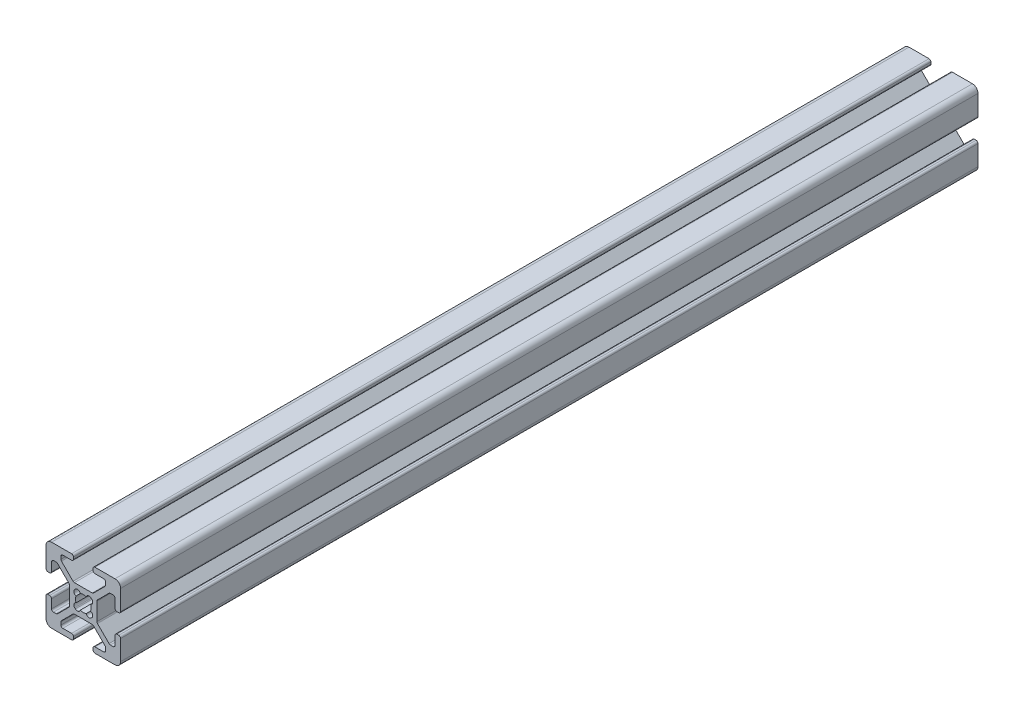
from build123d import *

# Parameters (mm, degrees)
BOSS_EXTRUDE1_DEPTH = 115


with BuildPart() as part:
    # Sketch1 → Boss-Extrude1 (new, symmetric)
    with BuildSketch(Plane.XY):
        with BuildLine():
            Line((10, 3.138), (10, 8.5))
            ThreePointArc((10, 8.5), (9.560660172, 9.560660172), (8.5, 10))
            Line((8.5, 10), (3.138, 10))
            ThreePointArc((3.138, 10), (2.778789755, 9.851210245), (2.63, 9.492))
            Line((2.63, 9.492), (2.63, 9.008))
            ThreePointArc((2.63, 9.008), (2.778789755, 8.648789755), (3.138, 8.5))
            Line((3.138, 8.5), (5.487, 8.5))
            ThreePointArc((5.487, 8.5), (5.846210245, 8.351210245), (5.995, 7.992))
            Line((5.995, 7.992), (5.995, 7.266080661))
            ThreePointArc((5.995, 7.266080661), (5.956330803, 7.071677478), (5.846210245, 6.906870417))
            Line((5.846210245, 6.906870417), (2.743129583, 3.803789755))
            ThreePointArc((2.743129583, 3.803789755), (2.578322522, 3.693669197), (2.383919339, 3.655))
            Line((2.383919339, 3.655), (-2.383919339, 3.655))
            ThreePointArc((-2.383919339, 3.655), (-2.578322522, 3.693669197), (-2.743129583, 3.803789755))
            Line((-2.743129583, 3.803789755), (-5.846210245, 6.906870417))
            ThreePointArc((-5.846210245, 6.906870417), (-5.956330803, 7.071677478), (-5.995, 7.266080661))
            Line((-5.995, 7.266080661), (-5.995, 7.992))
            ThreePointArc((-5.995, 7.992), (-5.846210245, 8.351210245), (-5.487, 8.5))
            Line((-5.487, 8.5), (-3.138, 8.5))
            ThreePointArc((-3.138, 8.5), (-2.778789755, 8.648789755), (-2.63, 9.008))
            Line((-2.63, 9.008), (-2.63, 9.492))
            ThreePointArc((-2.63, 9.492), (-2.778789755, 9.851210245), (-3.138, 10))
            Line((-3.138, 10), (-8.5, 10))
            ThreePointArc((-8.5, 10), (-9.560660172, 9.560660172), (-10, 8.5))
            Line((-10, 8.5), (-10, 3.138))
            ThreePointArc((-10, 3.138), (-9.851210245, 2.778789755), (-9.492, 2.63))
            Line((-9.492, 2.63), (-9.008, 2.63))
            ThreePointArc((-9.008, 2.63), (-8.648789755, 2.778789755), (-8.5, 3.138))
            Line((-8.5, 3.138), (-8.5, 5.487))
            ThreePointArc((-8.5, 5.487), (-8.351210245, 5.846210245), (-7.992, 5.995))
            Line((-7.992, 5.995), (-7.266080661, 5.995))
            ThreePointArc((-7.266080661, 5.995), (-7.071677478, 5.956330803), (-6.906870417, 5.846210245))
            Line((-6.906870417, 5.846210245), (-3.803789755, 2.743129583))
            ThreePointArc((-3.803789755, 2.743129583), (-3.693669197, 2.578322522), (-3.655, 2.383919339))
            Line((-3.655, 2.383919339), (-3.655, -2.383919339))
            ThreePointArc((-3.655, -2.383919339), (-3.693669197, -2.578322522), (-3.803789755, -2.743129583))
            Line((-3.803789755, -2.743129583), (-6.906870417, -5.846210245))
            ThreePointArc((-6.906870417, -5.846210245), (-7.071677478, -5.956330803), (-7.266080661, -5.995))
            Line((-7.266080661, -5.995), (-7.992, -5.995))
            ThreePointArc((-7.992, -5.995), (-8.351210245, -5.846210245), (-8.5, -5.487))
            Line((-8.5, -5.487), (-8.5, -3.138))
            ThreePointArc((-8.5, -3.138), (-8.648789755, -2.778789755), (-9.008, -2.63))
            Line((-9.008, -2.63), (-9.492, -2.63))
            ThreePointArc((-9.492, -2.63), (-9.851210245, -2.778789755), (-10, -3.138))
            Line((-10, -3.138), (-10, -8.5))
            ThreePointArc((-10, -8.5), (-9.560660172, -9.560660172), (-8.5, -10))
            Line((-8.5, -10), (-3.138, -10))
            ThreePointArc((-3.138, -10), (-2.778789755, -9.851210245), (-2.63, -9.492))
            Line((-2.63, -9.492), (-2.63, -9.008))
            ThreePointArc((-2.63, -9.008), (-2.778789755, -8.648789755), (-3.138, -8.5))
            Line((-3.138, -8.5), (-5.487, -8.5))
            ThreePointArc((-5.487, -8.5), (-5.846210245, -8.351210245), (-5.995, -7.992))
            Line((-5.995, -7.992), (-5.995, -7.266080661))
            ThreePointArc((-5.995, -7.266080661), (-5.956330803, -7.071677478), (-5.846210245, -6.906870417))
            Line((-5.846210245, -6.906870417), (-2.743129583, -3.803789755))
            ThreePointArc((-2.743129583, -3.803789755), (-2.578322522, -3.693669197), (-2.383919339, -3.655))
            Line((-2.383919339, -3.655), (2.383919339, -3.655))
            ThreePointArc((2.383919339, -3.655), (2.578322522, -3.693669197), (2.743129583, -3.803789755))
            Line((2.743129583, -3.803789755), (5.846210245, -6.906870417))
            ThreePointArc((5.846210245, -6.906870417), (5.956330803, -7.071677478), (5.995, -7.266080661))
            Line((5.995, -7.266080661), (5.995, -7.992))
            ThreePointArc((5.995, -7.992), (5.846210245, -8.351210245), (5.487, -8.5))
            Line((5.487, -8.5), (3.138, -8.5))
            ThreePointArc((3.138, -8.5), (2.778789755, -8.648789755), (2.63, -9.008))
            Line((2.63, -9.008), (2.63, -9.492))
            ThreePointArc((2.63, -9.492), (2.778789755, -9.851210245), (3.138, -10))
            Line((3.138, -10), (8.5, -10))
            ThreePointArc((8.5, -10), (9.560660172, -9.560660172), (10, -8.5))
            Line((10, -8.5), (10, -3.138))
            ThreePointArc((10, -3.138), (9.851210245, -2.778789755), (9.492, -2.63))
            Line((9.492, -2.63), (9.008, -2.63))
            ThreePointArc((9.008, -2.63), (8.648789755, -2.778789755), (8.5, -3.138))
            Line((8.5, -3.138), (8.5, -5.487))
            ThreePointArc((8.5, -5.487), (8.351210245, -5.846210245), (7.992, -5.995))
            Line((7.992, -5.995), (7.266080661, -5.995))
            ThreePointArc((7.266080661, -5.995), (7.071677478, -5.956330803), (6.906870417, -5.846210245))
            Line((6.906870417, -5.846210245), (3.803789755, -2.743129583))
            ThreePointArc((3.803789755, -2.743129583), (3.693669197, -2.578322522), (3.655, -2.383919339))
            Line((3.655, -2.383919339), (3.655, 2.383919339))
            ThreePointArc((3.655, 2.383919339), (3.693669197, 2.578322522), (3.803789755, 2.743129583))
            Line((3.803789755, 2.743129583), (6.906870417, 5.846210245))
            ThreePointArc((6.906870417, 5.846210245), (7.071677478, 5.956330803), (7.266080661, 5.995))
            Line((7.266080661, 5.995), (7.992, 5.995))
            ThreePointArc((7.992, 5.995), (8.351210245, 5.846210245), (8.5, 5.487))
            Line((8.5, 5.487), (8.5, 3.138))
            ThreePointArc((8.5, 3.138), (8.648789755, 2.778789755), (9.008, 2.63))
            Line((9.008, 2.63), (9.492, 2.63))
            ThreePointArc((9.492, 2.63), (9.851210245, 2.778789755), (10, 3.138))
        make_face()
        with BuildLine():
            Line((-2.124900844, -2.304505966), (-2.304505966, -2.124900844))
            ThreePointArc((-2.304505966, -2.124900844), (-2.505938017, -1.356467811), (-1.935133506, -0.803976718))
            ThreePointArc((-1.935133506, -0.803976718), (-2.0955, 0), (-1.935133506, 0.803976718))
            ThreePointArc((-1.935133506, 0.803976718), (-2.505938017, 1.356467811), (-2.304505966, 2.124900844))
            Line((-2.304505966, 2.124900844), (-2.124900844, 2.304505966))
            ThreePointArc((-2.124900844, 2.304505966), (-1.356467811, 2.505938017), (-0.803976718, 1.935133506))
            ThreePointArc((-0.803976718, 1.935133506), (0, 2.0955), (0.803976718, 1.935133506))
            ThreePointArc((0.803976718, 1.935133506), (1.356467811, 2.505938017), (2.124900844, 2.304505966))
            Line((2.124900844, 2.304505966), (2.304505966, 2.124900844))
            ThreePointArc((2.304505966, 2.124900844), (2.505938017, 1.356467811), (1.935133506, 0.803976718))
            ThreePointArc((1.935133506, 0.803976718), (2.0955, 0), (1.935133506, -0.803976718))
            ThreePointArc((1.935133506, -0.803976718), (2.505938017, -1.356467811), (2.304505966, -2.124900844))
            Line((2.304505966, -2.124900844), (2.124900844, -2.304505966))
            ThreePointArc((2.124900844, -2.304505966), (1.356467811, -2.505938017), (0.803976718, -1.935133506))
            ThreePointArc((0.803976718, -1.935133506), (0, -2.0955), (-0.803976718, -1.935133506))
            ThreePointArc((-0.803976718, -1.935133506), (-1.356467811, -2.505938017), (-2.124900844, -2.304505966))
        make_face(mode=Mode.SUBTRACT)
    extrude(amount=BOSS_EXTRUDE1_DEPTH, both=True)


solid = part.part
